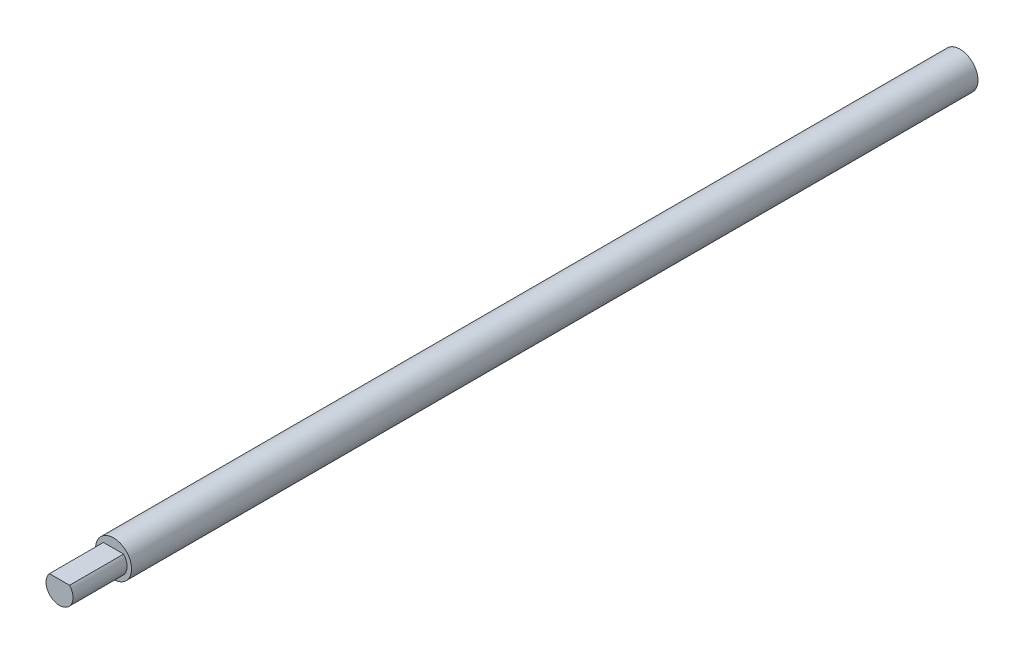
from build123d import *

# Parameters (mm, degrees)
ESBO_O1_R                  = 6.35
RESSALTO_EXTRUS_O1_DEPTH   = 200
ESBO_O2_R                  = 12.7
ESBO_O2_R_2                = 4
CORTE_EXTRUS_O1_DEPTH      = 201.201510983
CORTE_EXTRUS_O2_DEPTH      = 201.079984006
CORTE_EXTRUS_O2_DEPTH_BACK = 201.079984006
ESBO_O3_W                  = 12
ESBO_O3_H                  = 10
ESBO_O5_W                  = 12
ESBO_O5_H                  = 10


with BuildPart() as part:
    # Esboço1 → Ressalto-extrusão1 (new body)
    with BuildSketch(Plane.XY):
        Circle(ESBO_O1_R)
    extrude(amount=RESSALTO_EXTRUS_O1_DEPTH)

    # Esboço2 → Corte-extrusão1 (cut, through all)
    with BuildSketch(Plane.XY.offset(200)):
        Circle(ESBO_O2_R)
        Circle(ESBO_O2_R_2, mode=Mode.SUBTRACT)
    extrude(amount=-CORTE_EXTRUS_O1_DEPTH, mode=Mode.SUBTRACT)

    # Esboço3 → Corte-extrusão2 (cut, two sides: drawn at the far end of the back side and taken through both)
    with BuildSketch(Plane(origin=(0, 0, 0), x_dir=(0, 0, -1), z_dir=(1, 0, 0)).offset(-CORTE_EXTRUS_O2_DEPTH_BACK)):
        with Locations((-194, 7)):
            Rectangle(ESBO_O3_W, ESBO_O3_H)
    extrude(amount=CORTE_EXTRUS_O2_DEPTH + CORTE_EXTRUS_O2_DEPTH_BACK, mode=Mode.SUBTRACT)

    # Esboço5 → Corte-Revolução2 (revolve, cut)
    with BuildSketch(Plane(origin=(0, 0, 0), x_dir=(0, 0, -1), z_dir=(1, 0, 0)), mode=Mode.PRIVATE) as corte_revolu_o2_sk:
        with Locations((-194, 8)):
            Rectangle(ESBO_O5_W, ESBO_O5_H)
    revolve(corte_revolu_o2_sk.sketch.rotate(Axis((0, 0, 0), (0, 0, 1)), 270), axis=Axis((0, 0, 0), (0, 0, 1)), mode=Mode.SUBTRACT)


solid = part.part
